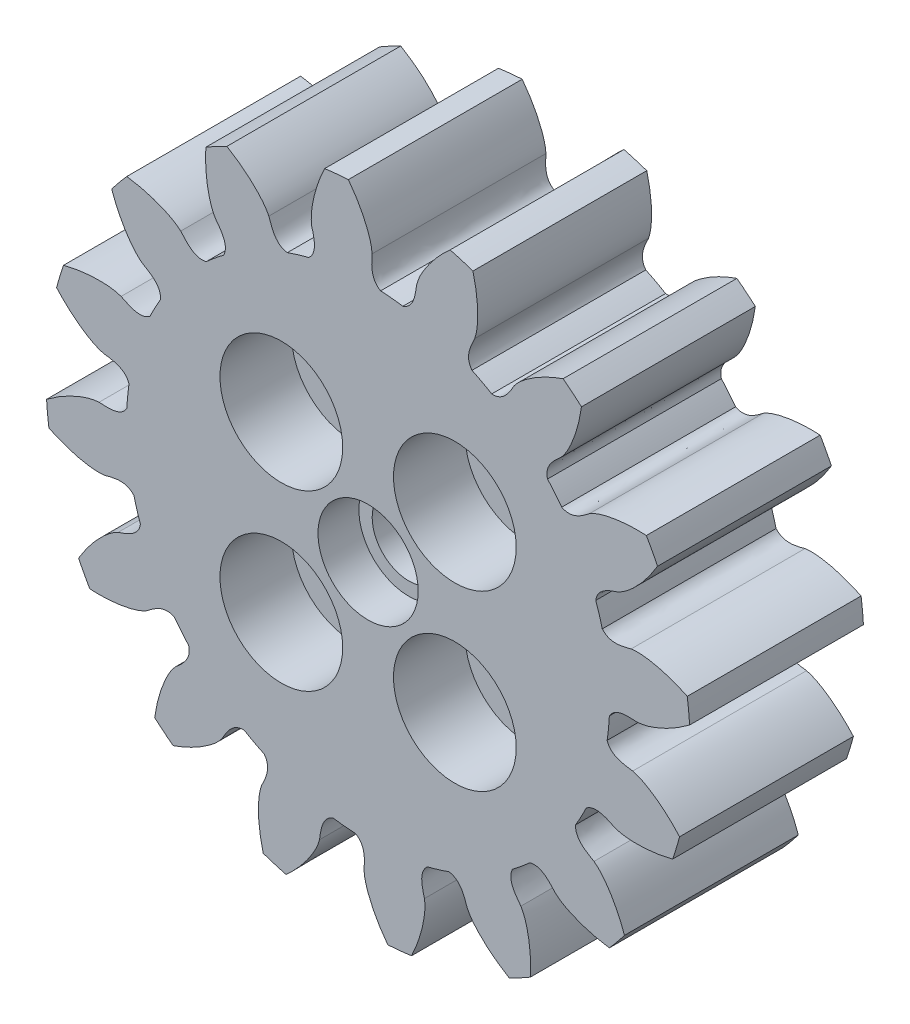
from build123d import *

# Parameters (mm, degrees)
SKETCH5_R           = 15.75
BOSS_EXTRUDE1_DEPTH = 8.5
CUT_EXTRUDE1_DEPTH  = 24.840616603
CIRPATTERN1_COUNT   = 16
SKETCH8_R           = 1.6
CUT_EXTRUDE3_DEPTH  = 24.801705108
SKETCH22_R          = 1.8
CUT_EXTRUDE7_DEPTH  = 24.801705108
SKETCH25_R          = 3
CUT_EXTRUDE11_DEPTH = 3.5
SKETCH26_R          = 2.45
CUT_EXTRUDE12_DEPTH = 2


with BuildPart() as part:
    # Sketch5 → Boss-Extrude1 (new body)
    with BuildSketch(Plane.XY):
        Circle(SKETCH5_R)
    extrude(amount=BOSS_EXTRUDE1_DEPTH)

    # Sketch4 → Cut-Extrude1 (cut, through all)
    with BuildSketch(Plane.XY):
        with BuildLine():
            ThreePointArc((0.611921535, 11.796639703), (1.15782747, 11.755619584), (1.701246604, 11.689350548))
            add(Edge.make_bspline(
                [(2.373961183, 12.93973198), (2.315625655, 12.475330162), (2.236877614, 11.863339564), (1.701246604, 11.689350548)],
                knots=[0, 0, 0, 0, 1, 1, 1, 1], degree=3))
            add(Edge.make_bspline(
                [(8.368063539, 17.589675074), (6.98568546, 17.162805829), (5.176821119, 16.308181248), (3.450723454, 14.735970074), (2.745111118, 13.809403347), (2.446145987, 13.221662125), (2.373961183, 12.93973198)],
                knots=[0, 0, 0, 0, 0.555544794, 0.749986395, 0.888874506, 1, 1, 1, 1], degree=3))
            ThreePointArc((8.368063539, 17.589675074), (1.909250001, 19.384940573), (-4.77569817, 18.88422261))
            add(Edge.make_bspline(
                [(-4.77569817, 18.88422261), (-3.503160157, 18.195866953), (-1.895781622, 17.004771817), (-0.509573624, 15.126025291), (0.001716368, 14.079604146), (0.180274344, 13.444831003), (0.196070294, 13.15423551)],
                knots=[0, 0, 0, 0, 0.555544794, 0.749986395, 0.888874506, 1, 1, 1, 1], degree=3))
            add(Edge.make_bspline(
                [(0.196070294, 13.15423551), (0.162684621, 12.687376346), (0.120526098, 12.071781995), (0.611921535, 11.796639703)],
                knots=[0, 0, 0, 0, 1, 1, 1, 1], degree=3))
        make_face()
    cut_extrude1 = extrude(amount=CUT_EXTRUDE1_DEPTH, mode=Mode.SUBTRACT)

    # CirPattern1: Cut-Extrude1 ×16 about axis
    cirpattern1_axis = Axis((0, 0, 8.5), (0, 0, -1))
    for i in range(1, CIRPATTERN1_COUNT):
        add(cut_extrude1.rotate(cirpattern1_axis, i * 360 / CIRPATTERN1_COUNT), mode=Mode.SUBTRACT)

    # Sketch8 → Cut-Extrude3 (cut, through all)
    with BuildSketch(Plane.XY.offset(8.5)):
        with Locations((-4.242640687, 4.242640687)):
            Circle(SKETCH8_R)
        with Locations((4.242640687, 4.242640687)):
            Circle(SKETCH8_R)
        with Locations((4.242640687, -4.242640687)):
            Circle(SKETCH8_R)
        with Locations((-4.242640687, -4.242640687)):
            Circle(SKETCH8_R)
    extrude(amount=-CUT_EXTRUDE3_DEPTH, mode=Mode.SUBTRACT)

    # Sketch22 → Cut-Extrude7 (cut, through all)
    with BuildSketch(Plane(origin=(0, 0, 0), x_dir=(-1, 0, 0), z_dir=(0, 0, -1))):
        Circle(SKETCH22_R)
    extrude(amount=-CUT_EXTRUDE7_DEPTH, mode=Mode.SUBTRACT)

    # Sketch25 → Cut-Extrude11 (cut)
    with BuildSketch(Plane.XY.offset(8.5)):
        with Locations((4.242640687, 4.242640687)):
            Circle(SKETCH25_R)
        with Locations((4.242640687, -4.242640687)):
            Circle(SKETCH25_R)
        with Locations((-4.242640687, -4.242640687)):
            Circle(SKETCH25_R)
        with Locations((-4.242640687, 4.242640687)):
            Circle(SKETCH25_R)
    extrude(amount=-CUT_EXTRUDE11_DEPTH, mode=Mode.SUBTRACT)

    # Sketch26 → Cut-Extrude12 (cut)
    with BuildSketch(Plane.XY.offset(8.5)):
        Circle(SKETCH26_R)
    extrude(amount=-CUT_EXTRUDE12_DEPTH, mode=Mode.SUBTRACT)


solid = part.part
